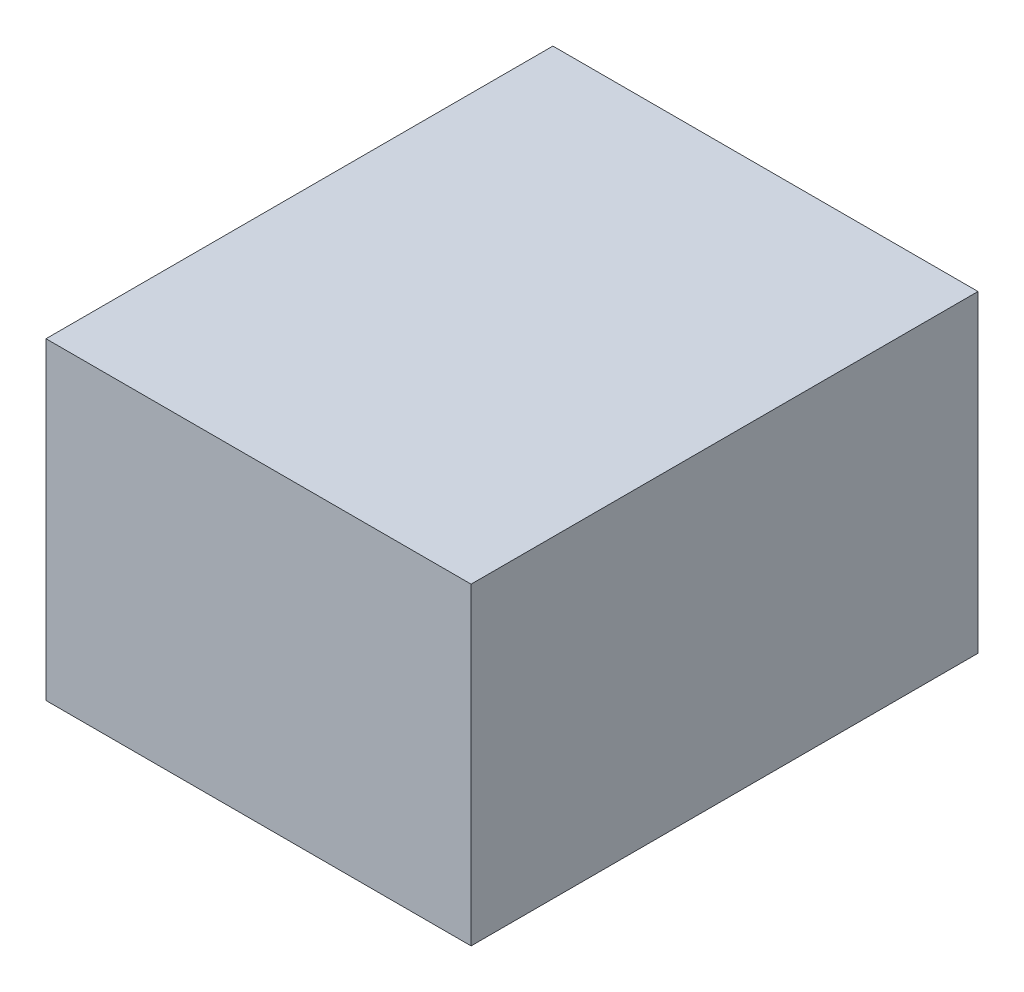
from build123d import *

# Parameters (mm, degrees)
SKETCH1_W           = 21.3
SKETCH1_H           = 25.4
BOSS_EXTRUDE1_DEPTH = 15.7


with BuildPart() as part:
    # Sketch1 → Boss-Extrude1 (new body)
    with BuildSketch(Plane(origin=(0, 0, 0), x_dir=(1, 0, 0), z_dir=(0, 1, 0))):
        with Locations((10.65, 12.7)):
            Rectangle(SKETCH1_W, SKETCH1_H)
    extrude(amount=BOSS_EXTRUDE1_DEPTH)


solid = part.part
